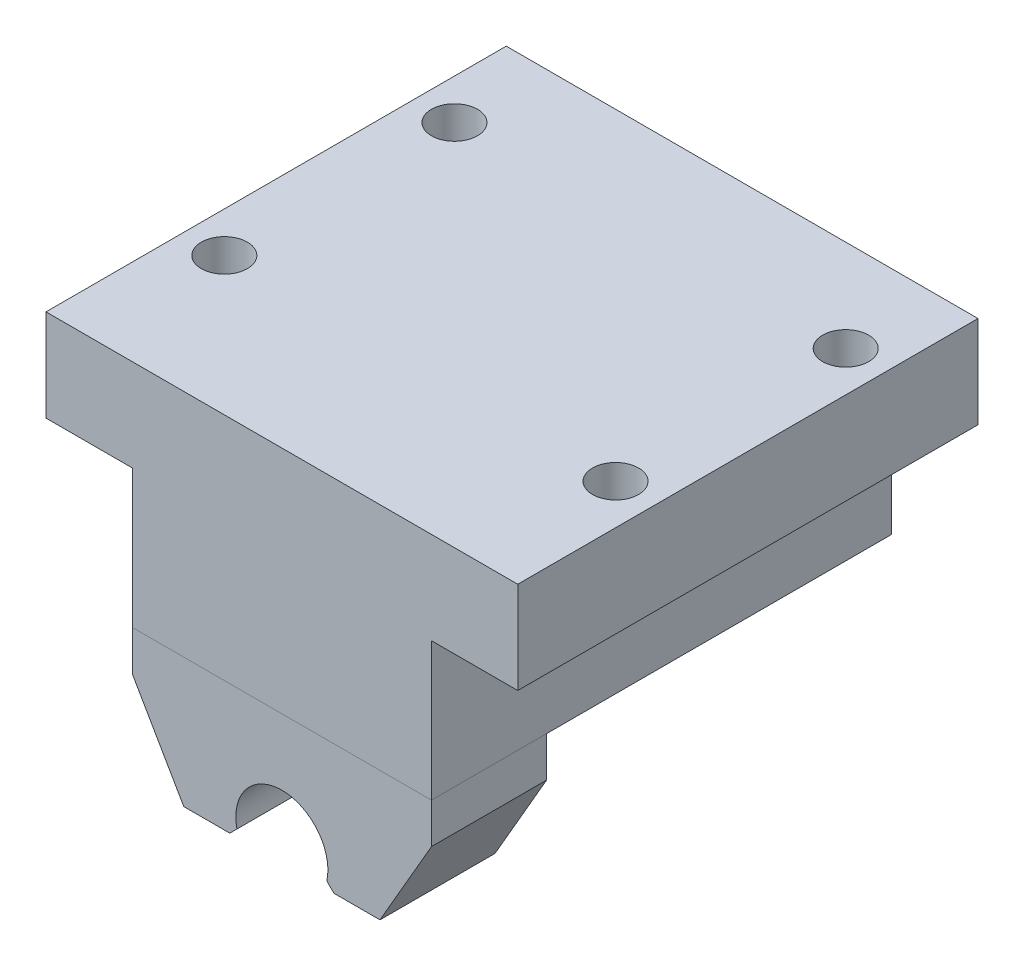
from build123d import *

# Parameters (mm, degrees)
BOSS_EXTRUDE1_DEPTH = 20
SKETCH2_R           = 2
CUT_EXTRUDE1_DEPTH  = 10
SKETCH3_R           = 5.075
CUT_EXTRUDE2_DEPTH  = 1.5
BOSS_EXTRUDE3_DEPTH = 10


with BuildPart() as part:
    # Sketch1 → Boss-Extrude1 (new, symmetric)
    with BuildSketch(Plane.XY):
        Polygon((13, -4), (20.5, -4), (20.5, 4), (-20.5, 4), (-20.5, -4), (-13, -4), (-13, -16), (13, -16), align=None)
    extrude(amount=BOSS_EXTRUDE1_DEPTH, both=True)

    # Sketch2 → Cut-Extrude1 (cut)
    with BuildSketch(Plane.XZ.offset(4)):
        with Locations(Location((-17, -12, 0), (0, 0, 270))):
            Circle(SKETCH2_R)
        with Locations(Location((-17, 8, 0), (0, 0, 270))):
            Circle(SKETCH2_R)
        with Locations(Location((17, -12, 0), (0, 0, 270))):
            Circle(SKETCH2_R)
        with Locations(Location((17, 8, 0), (0, 0, 270))):
            Circle(SKETCH2_R)
    extrude(amount=-CUT_EXTRUDE1_DEPTH, mode=Mode.SUBTRACT)

    # Sketch3 → Cut-Extrude2 (cut)
    with BuildSketch(Plane.XZ.offset(16)):
        with Locations(Location((0, -4.5, 0), (0, 0, 270))):
            Circle(SKETCH3_R)
    extrude(amount=-CUT_EXTRUDE2_DEPTH, mode=Mode.SUBTRACT)


with BuildPart() as body_2:
    # Sketch6 → Boss-Extrude3 (new body)
    with BuildSketch(Plane.XY.offset(20)):
        with BuildLine():
            Line((13, -16), (-13, -16))
            Line((-13, -16), (-13, -19.5))
            Line((-13, -19.5), (-8.525535414, -27.25))
            Line((-8.525535414, -27.25), (-4.525535414, -27.25))
            Line((-4.525535414, -27.25), (-3.902649266, -26.627113852))
            ThreePointArc((-3.902649266, -26.627113852), (0, -21.75), (3.902649266, -26.627113852))
            Line((3.902649266, -26.627113852), (4.525535414, -27.25))
            Line((4.525535414, -27.25), (8.525535414, -27.25))
            Line((8.525535414, -27.25), (13, -19.5))
            Line((13, -19.5), (13, -16))
        make_face()
    extrude(amount=-BOSS_EXTRUDE3_DEPTH)


solid = Compound([part.part, body_2.part])
